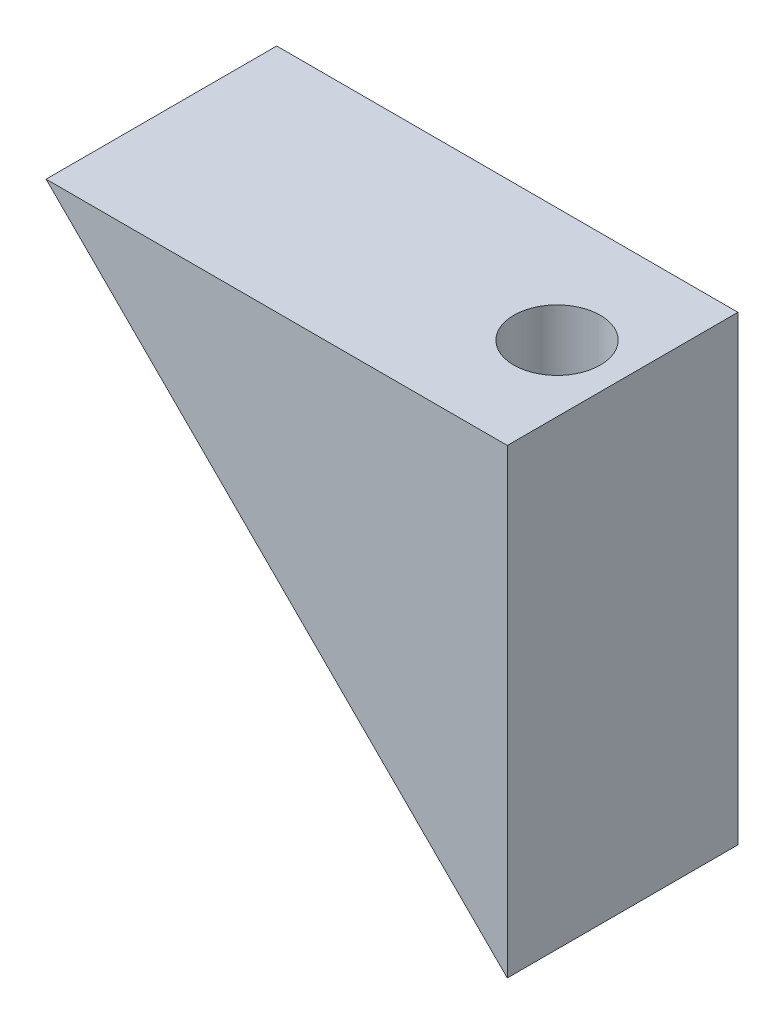
from build123d import *

# Parameters (mm, degrees)
BOSS_EXTRUDE1_DEPTH = 80
SKETCH2_R           = 15
CUT_EXTRUDE1_DEPTH  = 35
CUT_EXTRUDE2_START  = 35
SKETCH3_R           = 9.75
CUT_EXTRUDE2_DEPTH  = 120


with BuildPart() as part:
    # Sketch1 → Boss-Extrude1 (new body)
    with BuildSketch(Plane.XY):
        Polygon((80, 80), (80, -80), (-80, 80), align=None)
    extrude(amount=BOSS_EXTRUDE1_DEPTH)

    # Sketch2 → Cut-Extrude1 (cut)
    with BuildSketch(Plane(origin=(0, 80, 0), x_dir=(1, 0, 0), z_dir=(0, 1, 0))):
        with Locations(Location((57, -39.75, 0), (0, 0, 270))):
            Circle(SKETCH2_R)
    extrude(amount=-CUT_EXTRUDE1_DEPTH, mode=Mode.SUBTRACT)

    # Sketch3 → Cut-Extrude2 (cut)
    with BuildSketch(Plane(origin=(0, 45, 0), x_dir=(1, 0, 0), z_dir=(0, 1, 0)).offset(CUT_EXTRUDE2_START)):
        with Locations(Location((57, -39.75, 0), (0, 0, 270))):
            Circle(SKETCH3_R)
    extrude(amount=-CUT_EXTRUDE2_DEPTH, mode=Mode.SUBTRACT)


solid = part.part
